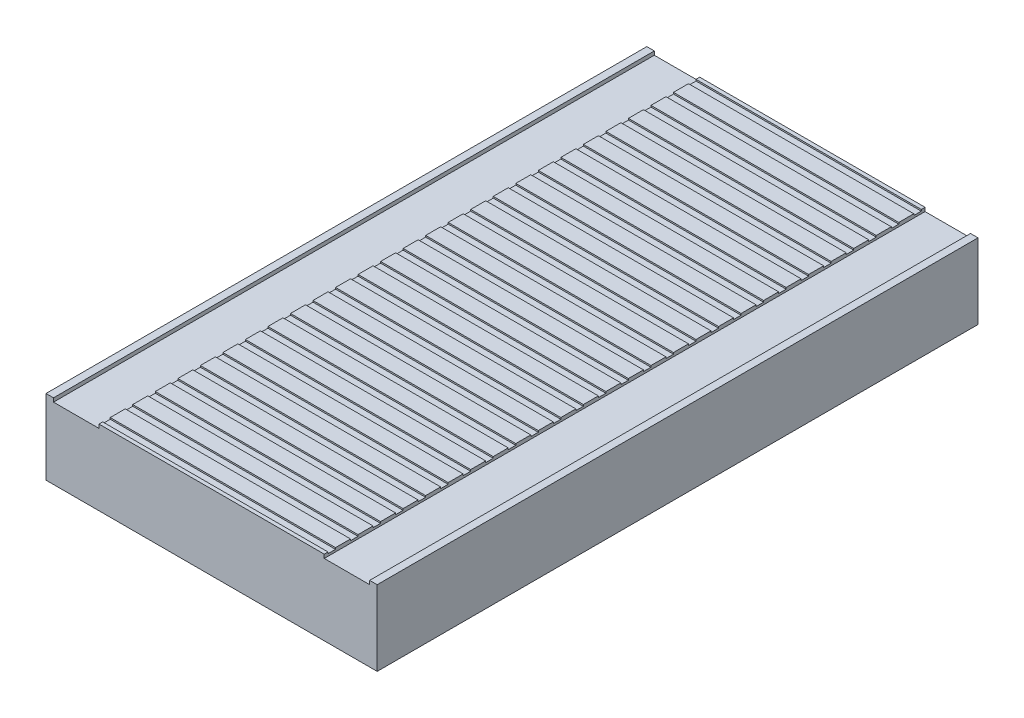
from build123d import *

# Parameters (mm, degrees)
SKETCH_1_W          = 441
SKETCH_1_H          = 800
EXTRUDE_1_DEPTH     = 95
SKETCH_3_W          = 10
SKETCH_3_H          = 800
SKETCH_3_W_2        = 300
EXTRUDE_2_DEPTH     = 5
SKETCH_4_W          = 300
SKETCH_4_H          = 10
CUT_EXTRUDE_1_DEPTH = 2


with BuildPart() as part:
    # 草图1 → 凸台-拉伸1 (new body)
    with BuildSketch(Plane(origin=(0, 0, 0), x_dir=(1, 0, 0), z_dir=(0, 1, 0))):
        with Locations((-220.5, 400)):
            Rectangle(SKETCH_1_W, SKETCH_1_H)
    extrude(amount=EXTRUDE_1_DEPTH)

    # 草图3 → 凸台-拉伸2 (add)
    with BuildSketch(Plane(origin=(0, 95, 0), x_dir=(1, 0, 0), z_dir=(0, 1, 0))):
        with Locations((-436, 400)):
            Rectangle(SKETCH_3_W, SKETCH_3_H)
        with Locations((-220.5, 400)):
            Rectangle(SKETCH_3_W_2, SKETCH_3_H)
        with Locations((-5, 400)):
            Rectangle(SKETCH_3_W, SKETCH_3_H)
    extrude(amount=EXTRUDE_2_DEPTH)

    # 草图4 → 切除-拉伸1 (cut)
    with BuildSketch(Plane(origin=(0, 100, 0), x_dir=(1, 0, 0), z_dir=(0, 1, 0))):
        with Locations((-220.5, 790)):
            Rectangle(SKETCH_4_W, SKETCH_4_H)
        with Locations((-220.5, 760)):
            Rectangle(SKETCH_4_W, SKETCH_4_H)
        with Locations((-220.5, 730)):
            Rectangle(SKETCH_4_W, SKETCH_4_H)
        with Locations((-220.5, 700)):
            Rectangle(SKETCH_4_W, SKETCH_4_H)
        with Locations((-220.5, 670)):
            Rectangle(SKETCH_4_W, SKETCH_4_H)
        with Locations((-220.5, 640)):
            Rectangle(SKETCH_4_W, SKETCH_4_H)
        with Locations((-220.5, 610)):
            Rectangle(SKETCH_4_W, SKETCH_4_H)
        with Locations((-220.5, 580)):
            Rectangle(SKETCH_4_W, SKETCH_4_H)
        with Locations((-220.5, 550)):
            Rectangle(SKETCH_4_W, SKETCH_4_H)
        with Locations((-220.5, 520)):
            Rectangle(SKETCH_4_W, SKETCH_4_H)
        with Locations((-220.5, 490)):
            Rectangle(SKETCH_4_W, SKETCH_4_H)
        with Locations((-220.5, 460)):
            Rectangle(SKETCH_4_W, SKETCH_4_H)
        with Locations((-220.5, 430)):
            Rectangle(SKETCH_4_W, SKETCH_4_H)
        with Locations((-220.5, 400)):
            Rectangle(SKETCH_4_W, SKETCH_4_H)
        with Locations((-220.5, 370)):
            Rectangle(SKETCH_4_W, SKETCH_4_H)
        with Locations((-220.5, 340)):
            Rectangle(SKETCH_4_W, SKETCH_4_H)
        with Locations((-220.5, 310)):
            Rectangle(SKETCH_4_W, SKETCH_4_H)
        with Locations((-220.5, 280)):
            Rectangle(SKETCH_4_W, SKETCH_4_H)
        with Locations((-220.5, 250)):
            Rectangle(SKETCH_4_W, SKETCH_4_H)
        with Locations((-220.5, 220)):
            Rectangle(SKETCH_4_W, SKETCH_4_H)
        with Locations((-220.5, 190)):
            Rectangle(SKETCH_4_W, SKETCH_4_H)
        with Locations((-220.5, 160)):
            Rectangle(SKETCH_4_W, SKETCH_4_H)
        with Locations((-220.5, 130)):
            Rectangle(SKETCH_4_W, SKETCH_4_H)
        with Locations((-220.5, 100)):
            Rectangle(SKETCH_4_W, SKETCH_4_H)
        with Locations((-220.5, 70)):
            Rectangle(SKETCH_4_W, SKETCH_4_H)
        with Locations((-220.5, 40)):
            Rectangle(SKETCH_4_W, SKETCH_4_H)
        with Locations((-220.5, 10)):
            Rectangle(SKETCH_4_W, SKETCH_4_H)
    extrude(amount=-CUT_EXTRUDE_1_DEPTH, mode=Mode.SUBTRACT)


solid = part.part
